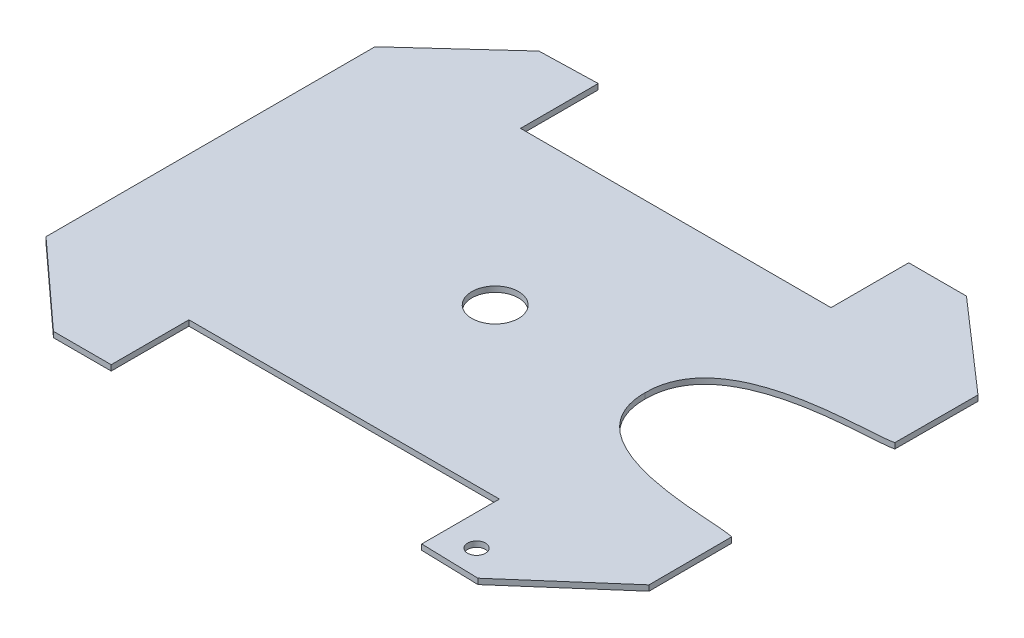
from build123d import *

# Parameters (mm, degrees)
EXTRUDE_1_DEPTH     = 5
SKETCH_2_R          = 21
CUT_EXTRUDE_1_DEPTH = 403.120979525
SKETCH1_R           = 8
CUT_EXTRUDE1_DEPTH  = 403.120979525


with BuildPart() as part:
    # Эскиз1 → Вытянуть1 (new body)
    with BuildSketch(Plane(origin=(0, 0, 0), x_dir=(1, 0, 0), z_dir=(0, 1, 0))):
        with BuildLine():
            Line((-269.7921816, 73.262575573), (-269.7921816, -223.012011978))
            Line((-269.7921816, -223.012011978), (-192.586469874, -293.492830448))
            Line((-192.586469874, -293.492830448), (-140.586469874, -293.492830448))
            Line((-140.586469874, -293.492830448), (-140.586469874, -223.492830448))
            Line((-140.586469874, -223.492830448), (139.068300868, -223.492830448))
            Line((139.068300868, -223.492830448), (139.068300868, -293.492830448))
            Line((139.068300868, -293.492830448), (191.068300868, -294.890935713))
            Line((191.068300868, -294.890935713), (273.341577689, -223.012011978))
            Line((273.341577689, -223.012011978), (273.101729514, -148.382005757))
            add(Edge.make_bspline(
                [(273.101729514, -148.382005757), (253.056193705, -142.743081174), (121.230792792, -151.614484767), (121.662419817, -74.874718203)],
                knots=[0, 0, 0, 0, 1, 1, 1, 1], degree=3))
            add(Edge.make_bspline(
                [(273.101729514, -1.367430648), (253.056193705, -7.006355231), (121.230792792, 1.865048362), (121.662419817, -74.874718203)],
                knots=[0, 0, 0, 0, 1, 1, 1, 1], degree=3))
            Line((273.101729514, -1.367430648), (273.341577689, 73.262575573))
            Line((273.341577689, 73.262575573), (191.068300868, 145.141499308))
            Line((191.068300868, 145.141499308), (139.068300868, 145.141499308))
            Line((139.068300868, 145.141499308), (139.068300868, 75.141499308))
            Line((139.068300868, 75.141499308), (-140.586469874, 75.141499308))
            Line((-140.586469874, 75.141499308), (-140.586469874, 145.141499308))
            Line((-140.586469874, 145.141499308), (-192.586469874, 143.743394043))
            Line((-192.586469874, 143.743394043), (-269.7921816, 73.262575573))
        make_face()
    extrude(amount=EXTRUDE_1_DEPTH)

    # Эскиз2 → Вырез-Вытянуть1 (cut, through all)
    with BuildSketch(Plane(origin=(0, 5, 0), x_dir=(-1, 0, 0), z_dir=(0, 1, 0))):
        with Locations(Location((14.229950912, 74.026657254, 0), (0, 0, 90))):
            Circle(SKETCH_2_R)
    extrude(amount=-CUT_EXTRUDE_1_DEPTH, mode=Mode.SUBTRACT)

    # Sketch1 → Cut-Extrude1 (cut, through all)
    with BuildSketch(Plane(origin=(0, 5, 0), x_dir=(1, 0, 0), z_dir=(0, 1, 0))):
        with Locations(Location((167.052967516, -272.065876514, 0), (0, 0, 270))):
            Circle(SKETCH1_R)
    extrude(amount=-CUT_EXTRUDE1_DEPTH, mode=Mode.SUBTRACT)


solid = part.part
